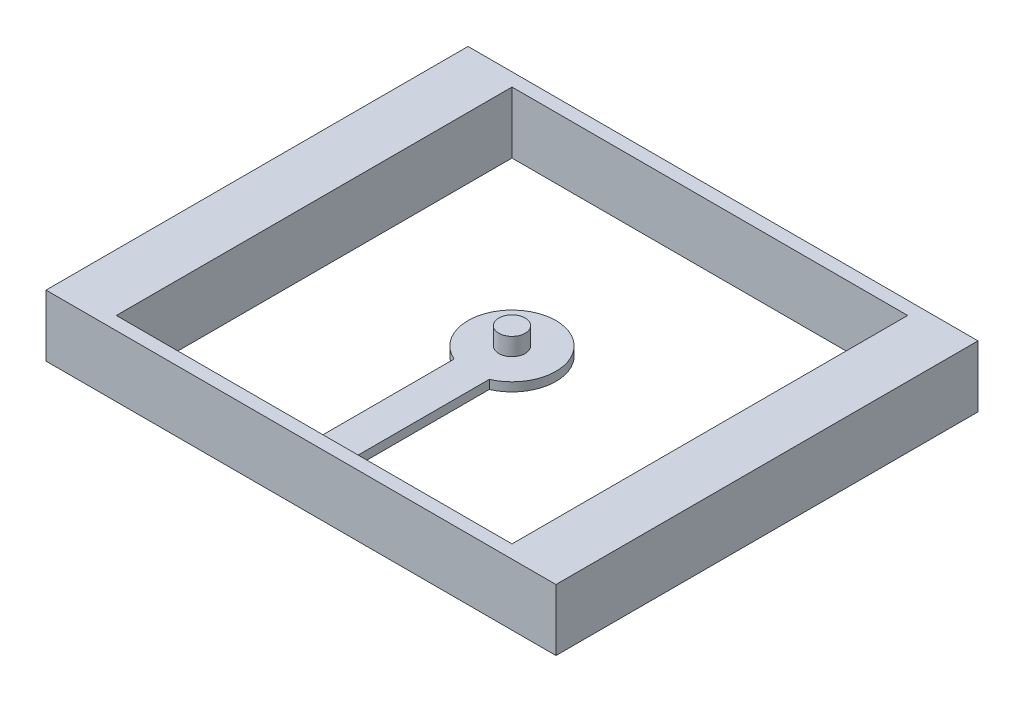
from build123d import *

# Parameters (mm, degrees)
SKETCH1_W           = 58
SKETCH1_H           = 7
BOSS_EXTRUDE1_DEPTH = 48
CUT_EXTRUDE1_DEPTH  = 3
CUT_EXTRUDE2_DEPTH  = 3
CUT_EXTRUDE3_DEPTH  = 3
SKETCH6_R           = 1.5
BOSS_EXTRUDE2_DEPTH = 2


with BuildPart() as part:
    # Sketch1 → Boss-Extrude1 (new body)
    with BuildSketch(Plane.XY):
        with Locations((29, -3.5)):
            Rectangle(SKETCH1_W, SKETCH1_H)
    extrude(amount=BOSS_EXTRUDE1_DEPTH)

    # Sketch2 → Cut-Extrude1 (cut)
    with BuildSketch(Plane(origin=(0, 0, 0), x_dir=(1, 0, 0), z_dir=(0, 1, 0))):
        Polygon((51.5, -42.620689655), (6.5, -5.379310345), (6.5, -46.5), (51.5, -46.5), align=None)
        Polygon((6.5, -1.5), (6.5, -5.379310345), (51.5, -42.620689655), (51.5, -1.5), align=None)
    extrude(amount=-CUT_EXTRUDE1_DEPTH, mode=Mode.SUBTRACT)

    # Sketch4 → Cut-Extrude2 (cut)
    with BuildSketch(Plane.XZ.offset(7)):
        Polygon((51.5, 5.379310345), (29, 24), (6.5, 5.379310345), (6.5, 1.5), (51.5, 1.5), align=None)
        Polygon((51.5, 42.620689655), (29, 24), (51.5, 5.379310345), align=None)
        Polygon((6.5, 46.5), (6.5, 42.620689655), (29, 24), (51.5, 42.620689655), (51.5, 46.5), align=None)
        Polygon((29, 24), (6.5, 42.620689655), (6.5, 5.379310345), align=None)
    extrude(amount=-CUT_EXTRUDE2_DEPTH, mode=Mode.SUBTRACT)

    # Sketch5 → Cut-Extrude3 (cut)
    with BuildSketch(Plane(origin=(0, -3, 0), x_dir=(1, 0, 0), z_dir=(0, 1, 0))):
        with BuildLine():
            Line((51.5, -1.5), (6.5, -1.5))
            Line((6.5, -1.5), (6.5, -46.5))
            Line((6.5, -46.5), (27, -46.5))
            Line((27, -46.5), (27, -28.582575695))
            ThreePointArc((27, -28.582575695), (29, -19), (31, -28.582575695))
            Line((31, -28.582575695), (31, -46.5))
            Line((31, -46.5), (51.5, -46.5))
            Line((51.5, -46.5), (51.5, -1.5))
        make_face()
    extrude(amount=-CUT_EXTRUDE3_DEPTH, mode=Mode.SUBTRACT)

    # Sketch6 → Boss-Extrude2 (add)
    with BuildSketch(Plane(origin=(0, -3, 0), x_dir=(1, 0, 0), z_dir=(0, 1, 0))):
        with Locations(Location((29, -24, 0), (0, 0, 270))):
            Circle(SKETCH6_R)
    extrude(amount=BOSS_EXTRUDE2_DEPTH)


solid = part.part
